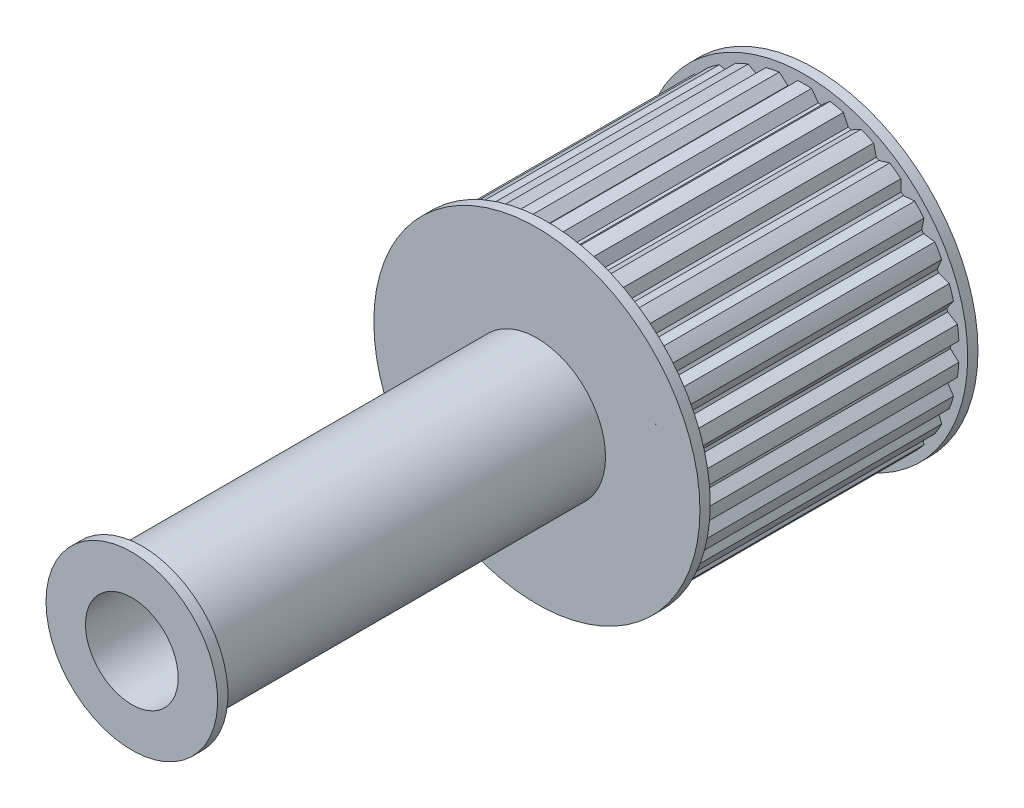
from build123d import *

# Parameters (mm, degrees)
SKETCH1_R           = 6.35
BOSS_EXTRUDE1_DEPTH = 0.762
SKETCH3_R           = 5.08
BOSS_EXTRUDE2_DEPTH = 29.21
SKETCH4_R           = 12.065
BOSS_EXTRUDE3_DEPTH = 0.762
SKETCH5_R           = 10.795
BOSS_EXTRUDE4_DEPTH = 19.05
BOSS_EXTRUDE6_START = -19.05
BOSS_EXTRUDE6_DEPTH = 19.05
SKETCH6_R           = 12.065
BOSS_EXTRUDE5_DEPTH = 0.762
CUT_EXTRUDE1_REACH  = 55.369
SKETCH7_R           = 3.429


with BuildPart() as part:
    # Sketch1 → Boss-Extrude1 (new body)
    with BuildSketch(Plane.XY):
        with Locations(Location((0, 0, 0), (0, 0, 180))):
            Circle(SKETCH1_R)
    extrude(amount=BOSS_EXTRUDE1_DEPTH)

    # Sketch3 → Boss-Extrude2 (add)
    with BuildSketch(Plane(origin=(0, 0, 0), x_dir=(-1, 0, 0), z_dir=(0, 0, -1))):
        with Locations(Location((0, 0, 0), (0, 0, 180))):
            Circle(SKETCH3_R)
    extrude(amount=BOSS_EXTRUDE2_DEPTH)

    # Sketch4 → Boss-Extrude3 (add)
    with BuildSketch(Plane(origin=(0, 0, -29.21), x_dir=(-1, 0, 0), z_dir=(0, 0, -1))):
        with Locations(Location((0, 0.091002199, 0), (0, 0, 180))):
            Circle(SKETCH4_R)
    extrude(amount=BOSS_EXTRUDE3_DEPTH)

    # Sketch5 → Boss-Extrude4 (add)
    with BuildSketch(Plane(origin=(0, 0, -29.972), x_dir=(-1, 0, 0), z_dir=(0, 0, -1))):
        with Locations(Location((0, 0, 0), (0, 0, 180))):
            Circle(SKETCH5_R)
    extrude(amount=BOSS_EXTRUDE4_DEPTH)

    # Sketch8 → Boss-Extrude6 (add)
    with BuildSketch(Plane(origin=(0, 0, -49.022), x_dir=(-1, 0, 0), z_dir=(0, 0, -1)).offset(BOSS_EXTRUDE6_START)):
        with BuildLine():
            Line((0, 10.795), (0, 11.43))
            ThreePointArc((0, 11.43), (-0.25406277, 11.427176034), (-0.508, 11.418705531))
            Line((-0.508, 11.418705531), (-1.016, 10.747081883))
            ThreePointArc((-1.016, 10.747081883), (-0.508564683, 10.783013816), (0, 10.795))
        make_face()
        with BuildLine():
            ThreePointArc((0.508, 11.418705531), (0.25406277, 11.427176034), (0, 11.43))
            Line((0, 11.43), (0, 10.795))
            ThreePointArc((0, 10.795), (0.508564683, 10.783013816), (1.016, 10.747081883))
            Line((1.016, 10.747081883), (0.508, 11.418705531))
        make_face()
        with BuildLine():
            ThreePointArc((2.870981355, 11.06356028), (2.376430626, 11.180227076), (1.877183393, 11.274798557))
            Line((1.877183393, 11.274798557), (1.240646003, 10.723470637))
            ThreePointArc((1.240646003, 10.723470637), (2.244406702, 10.55910335), (3.228241928, 10.300994081))
            Line((3.228241928, 10.300994081), (2.870981355, 11.06356028))
        make_face()
        with BuildLine():
            ThreePointArc((5.108487048, 10.224884355), (4.64899983, 10.441824581), (4.180324863, 10.638128785))
            Line((4.180324863, 10.638128785), (3.443069823, 10.231192266))
            ThreePointArc((3.443069823, 10.231192266), (4.390722062, 9.861723215), (5.299394193, 9.404703408))
            Line((5.299394193, 9.404703408), (5.108487048, 10.224884355))
        make_face()
        with BuildLine():
            ThreePointArc((7.122727344, 8.93933192), (6.718385434, 9.247064246), (6.300766078, 9.536521736))
            Line((6.300766078, 9.536521736), (5.49501497, 9.2917617))
            ThreePointArc((5.49501497, 9.2917617), (6.345141798, 8.733338454), (7.138937502, 8.097382067))
            Line((7.138937502, 8.097382067), (7.122727344, 8.93933192))
        make_face()
        with BuildLine():
            ThreePointArc((8.825670277, 7.263087784), (8.494145355, 7.648162831), (8.145833581, 8.018122927))
            Line((8.145833581, 8.018122927), (7.306801594, 7.94623656))
            ThreePointArc((7.306801594, 7.94623656), (8.022248391, 7.223264896), (8.666474986, 6.436166274))
            Line((8.666474986, 6.436166274), (8.825670277, 7.263087784))
        make_face()
        with BuildLine():
            Line((-1.240646003, 10.723470637), (-1.877183393, 11.274798557))
            ThreePointArc((-1.877183393, 11.274798557), (-2.376430626, 11.180227076), (-2.870981355, 11.06356028))
            Line((-2.870981355, 11.06356028), (-3.228241928, 10.300994081))
            ThreePointArc((-3.228241928, 10.300994081), (-2.244406702, 10.55910335), (-1.240646003, 10.723470637))
        make_face()
        with BuildLine():
            Line((-3.443069823, 10.231192266), (-4.180324863, 10.638128785))
            ThreePointArc((-4.180324863, 10.638128785), (-4.64899983, 10.441824581), (-5.108487048, 10.224884355))
            Line((-5.108487048, 10.224884355), (-5.299394193, 9.404703408))
            ThreePointArc((-5.299394193, 9.404703408), (-4.390722062, 9.861723215), (-3.443069823, 10.231192266))
        make_face()
        with BuildLine():
            ThreePointArc((10.142889068, 5.26941186), (9.898670365, 5.715), (9.634889068, 6.149293671))
            Line((9.634889068, 6.149293671), (8.799245927, 6.253422752))
            ThreePointArc((8.799245927, 6.253422752), (9.348744234, 5.3975), (9.815245927, 4.493659131))
            Line((9.815245927, 4.493659131), (10.142889068, 5.26941186))
        make_face()
        with BuildLine():
            ThreePointArc((11.016814936, 3.045437353), (10.870575981, 3.532064246), (10.70285367, 4.011710773))
            Line((10.70285367, 4.011710773), (9.90712099, 4.287304362))
            ThreePointArc((9.90712099, 4.287304362), (10.266655093, 3.335838454), (10.535043522, 2.354757521))
            Line((10.535043522, 2.354757521), (11.016814936, 3.045437353))
        make_face()
        with BuildLine():
            ThreePointArc((11.409253127, 0.688362619), (11.367385264, 1.194760335), (11.303052208, 1.698796864))
            Line((11.303052208, 1.698796864), (10.582007325, 2.1338102))
            ThreePointArc((10.582007325, 2.1338102), (10.735863861, 1.128384761), (10.794409163, 0.112941708))
            Line((10.794409163, 0.112941708), (11.409253127, 0.688362619))
        make_face()
        with BuildLine():
            ThreePointArc((10.794409163, -0.112941708), (10.735863861, -1.128384761), (10.582007325, -2.1338102))
            Line((10.582007325, -2.1338102), (11.303052208, -1.698796864))
            ThreePointArc((11.303052208, -1.698796864), (11.367385264, -1.194760335), (11.409253127, -0.688362619))
            Line((11.409253127, -0.688362619), (10.794409163, -0.112941708))
        make_face()
        with BuildLine():
            ThreePointArc((10.535043522, -2.354757521), (10.266655093, -3.335838454), (9.90712099, -4.287304362))
            Line((9.90712099, -4.287304362), (10.70285367, -4.011710773))
            ThreePointArc((10.70285367, -4.011710773), (10.870575981, -3.532064246), (11.016814936, -3.045437353))
            Line((11.016814936, -3.045437353), (10.535043522, -2.354757521))
        make_face()
        with BuildLine():
            ThreePointArc((9.815245927, -4.493659131), (9.348744234, -5.3975), (8.799245927, -6.253422752))
            Line((8.799245927, -6.253422752), (9.634889068, -6.149293671))
            ThreePointArc((9.634889068, -6.149293671), (9.898670365, -5.715), (10.142889068, -5.26941186))
            Line((10.142889068, -5.26941186), (9.815245927, -4.493659131))
        make_face()
        with BuildLine():
            ThreePointArc((8.666474986, -6.436166274), (8.022248391, -7.223264896), (7.306801594, -7.94623656))
            Line((7.306801594, -7.94623656), (8.145833581, -8.018122927))
            ThreePointArc((8.145833581, -8.018122927), (8.494145355, -7.648162831), (8.825670277, -7.263087784))
            Line((8.825670277, -7.263087784), (8.666474986, -6.436166274))
        make_face()
        with BuildLine():
            ThreePointArc((7.138937502, -8.097382067), (6.345141799, -8.733338454), (5.49501497, -9.2917617))
            Line((5.49501497, -9.2917617), (6.300766078, -9.536521736))
            ThreePointArc((6.300766078, -9.536521736), (6.718385434, -9.247064246), (7.122727344, -8.93933192))
            Line((7.122727344, -8.93933192), (7.138937502, -8.097382067))
        make_face()
        with BuildLine():
            ThreePointArc((5.299394193, -9.404703408), (4.390722062, -9.861723215), (3.443069823, -10.231192266))
            Line((3.443069823, -10.231192266), (4.180324863, -10.638128785))
            ThreePointArc((4.180324863, -10.638128785), (4.64899983, -10.441824581), (5.108487048, -10.224884355))
            Line((5.108487048, -10.224884355), (5.299394193, -9.404703408))
        make_face()
        with BuildLine():
            ThreePointArc((3.228241928, -10.300994081), (2.244406702, -10.55910335), (1.240646003, -10.723470637))
            Line((1.240646003, -10.723470637), (1.877183393, -11.274798557))
            ThreePointArc((1.877183393, -11.274798557), (2.376430626, -11.180227076), (2.870981355, -11.06356028))
            Line((2.870981355, -11.06356028), (3.228241928, -10.300994081))
        make_face()
        with BuildLine():
            ThreePointArc((1.016, -10.747081883), (0.508564683, -10.783013816), (0, -10.795))
            Line((0, -10.795), (0, -11.43))
            ThreePointArc((0, -11.43), (0.25406277, -11.427176034), (0.508, -11.418705531))
            Line((0.508, -11.418705531), (1.016, -10.747081883))
        make_face()
        with BuildLine():
            Line((0, -11.43), (0, -10.795))
            ThreePointArc((0, -10.795), (-0.508564683, -10.783013816), (-1.016, -10.747081883))
            Line((-1.016, -10.747081883), (-0.508, -11.418705531))
            ThreePointArc((-0.508, -11.418705531), (-0.25406277, -11.427176034), (0, -11.43))
        make_face()
        with BuildLine():
            Line((-1.877183393, -11.274798557), (-1.240646003, -10.723470637))
            ThreePointArc((-1.240646003, -10.723470637), (-2.244406702, -10.55910335), (-3.228241928, -10.300994081))
            Line((-3.228241928, -10.300994081), (-2.870981355, -11.06356028))
            ThreePointArc((-2.870981355, -11.06356028), (-2.376430626, -11.180227076), (-1.877183393, -11.274798557))
        make_face()
        with BuildLine():
            Line((-4.180324863, -10.638128785), (-3.443069823, -10.231192266))
            ThreePointArc((-3.443069823, -10.231192266), (-4.390722062, -9.861723215), (-5.299394193, -9.404703408))
            Line((-5.299394193, -9.404703408), (-5.108487048, -10.224884355))
            ThreePointArc((-5.108487048, -10.224884355), (-4.64899983, -10.441824581), (-4.180324863, -10.638128785))
        make_face()
        with BuildLine():
            Line((-6.300766078, -9.536521736), (-5.49501497, -9.2917617))
            ThreePointArc((-5.49501497, -9.2917617), (-6.345141798, -8.733338454), (-7.138937502, -8.097382067))
            Line((-7.138937502, -8.097382067), (-7.122727344, -8.93933192))
            ThreePointArc((-7.122727344, -8.93933192), (-6.718385434, -9.247064246), (-6.300766078, -9.536521736))
        make_face()
        with BuildLine():
            Line((-8.145833581, -8.018122927), (-7.306801594, -7.94623656))
            ThreePointArc((-7.306801594, -7.94623656), (-8.022248391, -7.223264896), (-8.666474986, -6.436166274))
            Line((-8.666474986, -6.436166274), (-8.825670277, -7.263087784))
            ThreePointArc((-8.825670277, -7.263087784), (-8.494145355, -7.648162831), (-8.145833581, -8.018122927))
        make_face()
        with BuildLine():
            Line((-9.634889068, -6.149293671), (-8.799245927, -6.253422752))
            ThreePointArc((-8.799245927, -6.253422752), (-9.348744234, -5.3975), (-9.815245927, -4.493659131))
            Line((-9.815245927, -4.493659131), (-10.142889068, -5.26941186))
            ThreePointArc((-10.142889068, -5.26941186), (-9.898670365, -5.715), (-9.634889068, -6.149293671))
        make_face()
        with BuildLine():
            Line((-10.70285367, -4.011710773), (-9.90712099, -4.287304362))
            ThreePointArc((-9.90712099, -4.287304362), (-10.266655093, -3.335838454), (-10.535043522, -2.354757521))
            Line((-10.535043522, -2.354757521), (-11.016814936, -3.045437353))
            ThreePointArc((-11.016814936, -3.045437353), (-10.870575981, -3.532064246), (-10.70285367, -4.011710773))
        make_face()
        with BuildLine():
            Line((-11.303052208, -1.698796864), (-10.582007325, -2.1338102))
            ThreePointArc((-10.582007325, -2.1338102), (-10.735863861, -1.128384761), (-10.794409163, -0.112941708))
            Line((-10.794409163, -0.112941708), (-11.409253127, -0.688362619))
            ThreePointArc((-11.409253127, -0.688362619), (-11.367385264, -1.194760335), (-11.303052208, -1.698796864))
        make_face()
        with BuildLine():
            Line((-10.582007325, 2.1338102), (-11.303052208, 1.698796864))
            ThreePointArc((-11.303052208, 1.698796864), (-11.367385264, 1.194760335), (-11.409253127, 0.688362619))
            Line((-11.409253127, 0.688362619), (-10.794409163, 0.112941708))
            ThreePointArc((-10.794409163, 0.112941708), (-10.735863861, 1.128384761), (-10.582007325, 2.1338102))
        make_face()
        with BuildLine():
            Line((-9.90712099, 4.287304362), (-10.70285367, 4.011710773))
            ThreePointArc((-10.70285367, 4.011710773), (-10.870575981, 3.532064246), (-11.016814936, 3.045437353))
            Line((-11.016814936, 3.045437353), (-10.535043522, 2.354757521))
            ThreePointArc((-10.535043522, 2.354757521), (-10.266655093, 3.335838454), (-9.90712099, 4.287304362))
        make_face()
        with BuildLine():
            Line((-8.799245927, 6.253422752), (-9.634889068, 6.149293671))
            ThreePointArc((-9.634889068, 6.149293671), (-9.898670365, 5.715), (-10.142889068, 5.26941186))
            Line((-10.142889068, 5.26941186), (-9.815245927, 4.493659131))
            ThreePointArc((-9.815245927, 4.493659131), (-9.348744234, 5.3975), (-8.799245927, 6.253422752))
        make_face()
        with BuildLine():
            Line((-7.306801594, 7.94623656), (-8.145833581, 8.018122927))
            ThreePointArc((-8.145833581, 8.018122927), (-8.494145355, 7.648162831), (-8.825670277, 7.263087784))
            Line((-8.825670277, 7.263087784), (-8.666474986, 6.436166274))
            ThreePointArc((-8.666474986, 6.436166274), (-8.022248391, 7.223264896), (-7.306801594, 7.94623656))
        make_face()
        with BuildLine():
            Line((-5.49501497, 9.2917617), (-6.300766078, 9.536521736))
            ThreePointArc((-6.300766078, 9.536521736), (-6.718385434, 9.247064246), (-7.122727344, 8.93933192))
            Line((-7.122727344, 8.93933192), (-7.138937502, 8.097382067))
            ThreePointArc((-7.138937502, 8.097382067), (-6.345141798, 8.733338454), (-5.49501497, 9.2917617))
        make_face()
    extrude(amount=BOSS_EXTRUDE6_DEPTH)

    # Sketch6 → Boss-Extrude5 (add)
    with BuildSketch(Plane(origin=(0, 0, -49.022), x_dir=(-1, 0, 0), z_dir=(0, 0, -1))):
        with Locations(Location((0, 0, 0), (0, 0, 180))):
            Circle(SKETCH6_R)
    extrude(amount=BOSS_EXTRUDE5_DEPTH)

    # Sketch7 → Cut-Extrude1 (cut, up to next)
    with BuildSketch(Plane(origin=(0, 0, -49.784), x_dir=(-1, 0, 0), z_dir=(0, 0, -1)), mode=Mode.PRIVATE) as cut_extrude1_sk1:
        Circle(SKETCH7_R)
    cut_extrude1_tool1 = extrude(cut_extrude1_sk1.sketch, amount=-CUT_EXTRUDE1_REACH, mode=Mode.PRIVATE) & part.part
    add(cut_extrude1_tool1.solids().sort_by_distance((0, 0, -49.784))[0], mode=Mode.SUBTRACT)


solid = part.part
